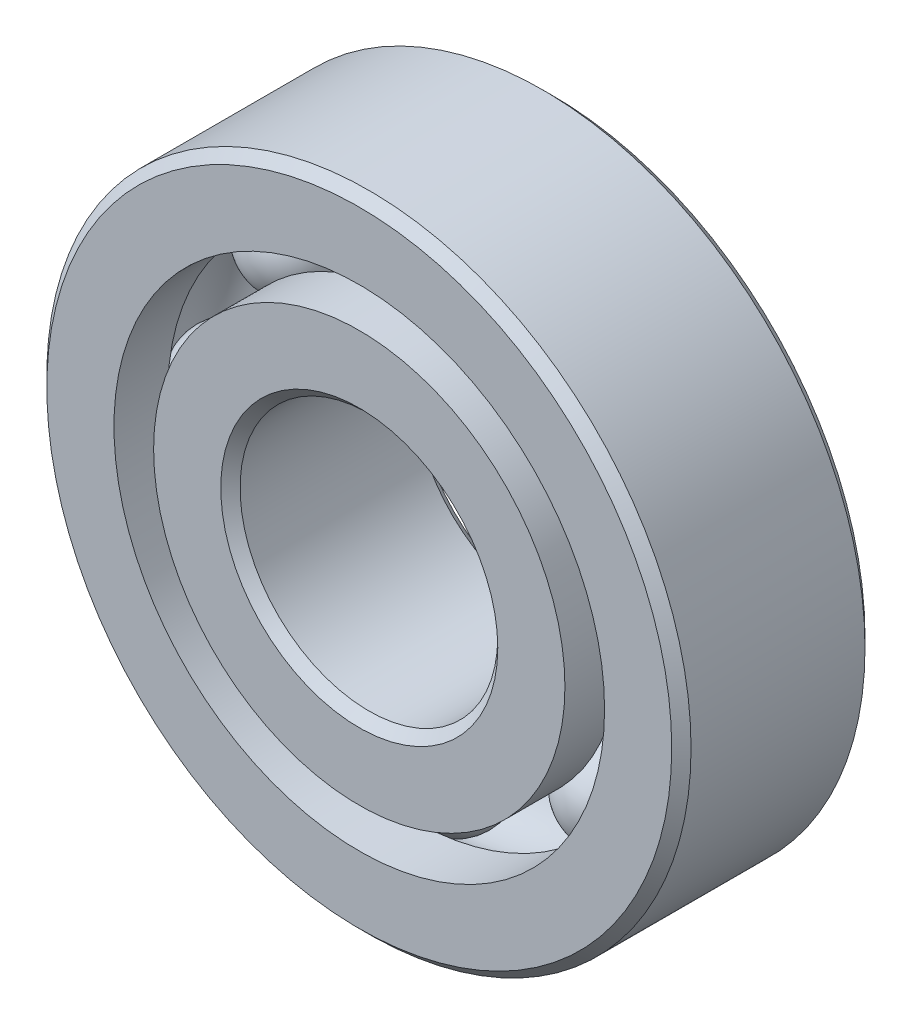
from build123d import *

# Parameters (mm, degrees)
CIRPATTERN1_COUNT = 8


with BuildPart() as part:
    # Sketch1 → Revolve1 (revolve)
    with BuildSketch(Plane(origin=(0, 0, 0), x_dir=(0, 0, -1), z_dir=(1, 0, 0)), mode=Mode.PRIVATE) as revolve1_sk:
        with BuildLine():
            Line((2.143125, 7.9375), (-2.143125, 7.9375))
            Line((-2.143125, 7.9375), (-2.38125, 7.699375))
            Line((-2.38125, 7.699375), (-2.38125, 6.044711538))
            Line((-2.38125, 6.044711538), (-1.058333333, 6.044711538))
            ThreePointArc((-1.058333333, 6.044711538), (0, 6.721867484), (1.058333333, 6.044711538))
            Line((1.058333333, 6.044711538), (2.38125, 6.044711538))
            Line((2.38125, 6.044711538), (2.38125, 7.699375))
            Line((2.38125, 7.699375), (2.143125, 7.9375))
        make_face()
    revolve(revolve1_sk.sketch.rotate(Axis((0, 0, 2.38125), (0, 0, -1)), 90), axis=Axis((0, 0, 2.38125), (0, 0, -1)))


with BuildPart() as body_2:
    # Sketch3 → Revolve3 (revolve)
    with BuildSketch(Plane(origin=(0, 0, 0), x_dir=(0, 0, -1), z_dir=(1, 0, 0)), mode=Mode.PRIVATE) as revolve3_sk:
        with BuildLine():
            Line((-2.38125, 5.067788462), (-1.058333333, 5.067788462))
            ThreePointArc((-1.058333333, 5.067788462), (0, 4.390632516), (1.058333333, 5.067788462))
            Line((1.058333333, 5.067788462), (2.38125, 5.067788462))
            Line((2.38125, 5.067788462), (2.38125, 3.413125))
            Line((2.38125, 3.413125), (2.143125, 3.175))
            Line((2.143125, 3.175), (-2.143125, 3.175))
            Line((-2.143125, 3.175), (-2.38125, 3.413125))
            Line((-2.38125, 3.413125), (-2.38125, 5.067788462))
        make_face()
    revolve(revolve3_sk.sketch.rotate(Axis((0, 0, 2.38125), (0, 0, -1)), 90), axis=Axis((0, 0, 2.38125), (0, 0, -1)))


with BuildPart() as body_3:
    # Sketch4 → Revolve4 (revolve)
    with BuildSketch(Plane(origin=(0, 0, 0), x_dir=(0, 0, -1), z_dir=(1, 0, 0))):
        with BuildLine():
            Line((-1.165617484, 5.55625), (1.165617484, 5.55625))
            ThreePointArc((1.165617484, 5.55625), (0, 6.721867484), (-1.165617484, 5.55625))
        make_face()
    revolve(axis=Axis((0, 5.55625, 1.165617484), (0, 0, -1)))


with BuildPart() as cirpattern1_1:
    # CirPattern1: pattern copy
    add(body_3.part.rotate(Axis((0, 0, 0), (0, 0, 1)), 1 * 360 / CIRPATTERN1_COUNT))


with BuildPart() as cirpattern1_2:
    # CirPattern1: pattern copy
    add(body_3.part.rotate(Axis((0, 0, 0), (0, 0, 1)), 2 * 360 / CIRPATTERN1_COUNT))


with BuildPart() as cirpattern1_3:
    # CirPattern1: pattern copy
    add(body_3.part.rotate(Axis((0, 0, 0), (0, 0, 1)), 3 * 360 / CIRPATTERN1_COUNT))


with BuildPart() as cirpattern1_4:
    # CirPattern1: pattern copy
    add(body_3.part.rotate(Axis((0, 0, 0), (0, 0, 1)), 4 * 360 / CIRPATTERN1_COUNT))


with BuildPart() as cirpattern1_5:
    # CirPattern1: pattern copy
    add(body_3.part.rotate(Axis((0, 0, 0), (0, 0, 1)), 5 * 360 / CIRPATTERN1_COUNT))


with BuildPart() as cirpattern1_6:
    # CirPattern1: pattern copy
    add(body_3.part.rotate(Axis((0, 0, 0), (0, 0, 1)), 6 * 360 / CIRPATTERN1_COUNT))


with BuildPart() as cirpattern1_7:
    # CirPattern1: pattern copy
    add(body_3.part.rotate(Axis((0, 0, 0), (0, 0, 1)), 7 * 360 / CIRPATTERN1_COUNT))


solid = Compound([part.part, body_2.part, body_3.part, cirpattern1_1.part, cirpattern1_2.part, cirpattern1_3.part, cirpattern1_4.part, cirpattern1_5.part, cirpattern1_6.part, cirpattern1_7.part])
